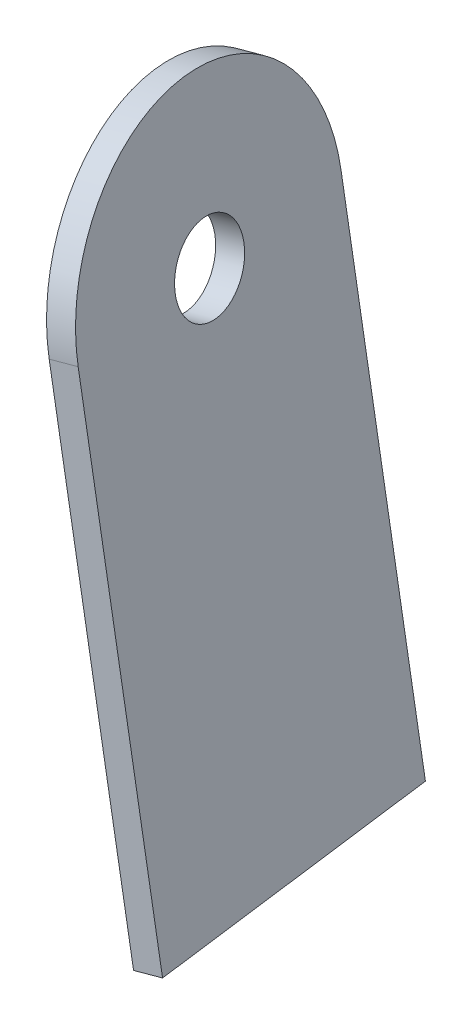
from build123d import *

# Parameters (mm, degrees)
SKETCH2_R           = 2.4892
BOSS_EXTRUDE1_DEPTH = 1.5875


with BuildPart() as part:
    # Sketch2 → Boss-Extrude1 (new body)
    with BuildSketch(Plane(origin=(-406.836680709, 67.862442728, -60.114831645), x_dir=(-0.15204147849631244, -0.03655570855361372, 0.9876978632095945), z_dir=(0.9760593070661704, -0.16281169315785926, 0.1442240675496927))):
        with BuildLine():
            Line((-544.785785419, 305.655391385), (-546.457439277, 275.221266239))
            ThreePointArc((-546.457439277, 275.221266239), (-537.469166999, 265.1882103), (-527.436111061, 274.176482578))
            Line((-527.436111061, 274.176482578), (-525.764457203, 304.610607723))
            Line((-525.764457203, 304.610607723), (-544.785785419, 305.655391385))
        make_face()
        with Locations(Location((-536.946775169, 274.698874408, 0), (0, 0, 86.498585174))):
            Circle(SKETCH2_R, mode=Mode.SUBTRACT)
    extrude(amount=BOSS_EXTRUDE1_DEPTH)


with BuildPart() as body_2:
    # Mirror2: mirrored copy
    add(part.part.mirror(Plane(origin=(0, 0, 0), x_dir=(0, 0, 1), z_dir=(1, 0, 0))))


solid = body_2.part
